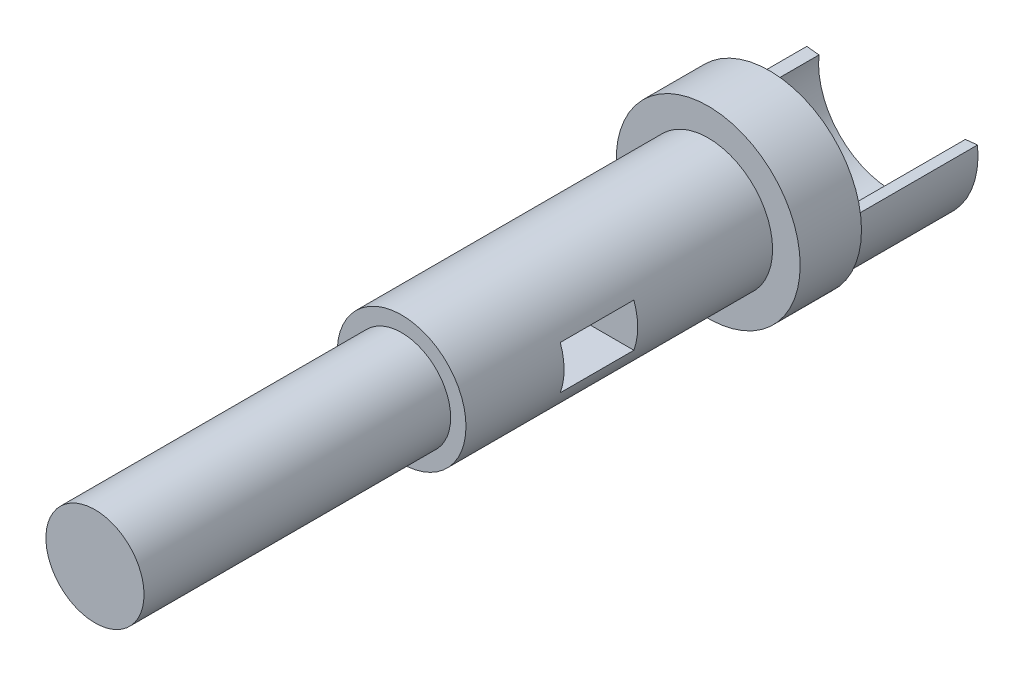
from build123d import *

# Parameters (mm, degrees)
BOSS_EXTRUDE3_DEPTH = 20
SKETCH4_W           = 12
SKETCH4_H           = 7.1
CUT_EXTRUDE1_DEPTH  = 132.719398723


with BuildPart() as part:
    # Sketch2 → Revolve4 (revolve)
    with BuildSketch(Plane(origin=(0, 0, 0), x_dir=(1, 0, 0), z_dir=(0, 1, 0))):
        Polygon((0, 0), (8, 0), (8, 50), (10.5, 50), (10.5, 100), (15, 100), (15, 110), (0, 110), align=None)
    revolve(axis=Axis((0, 0, 0), (0, 0, -1)))

    # Sketch3 → Boss-Extrude3 (add)
    with BuildSketch(Plane(origin=(0, 0, -110), x_dir=(-1, 0, 0), z_dir=(0, 0, -1))):
        with BuildLine():
            Line((-14, 0), (-12, 0))
            ThreePointArc((-12, 0), (-11.983554417, 0.628031475), (-11.934262744, 1.254341559))
            Line((-11.934262744, 1.254341559), (-13.923306535, 1.463398486))
            ThreePointArc((-13.923306535, 1.463398486), (-13.980813487, 0.732703387), (-14, 0))
        make_face()
        with BuildLine():
            Line((14, 0), (12, 0))
            ThreePointArc((12, 0), (0, -12), (-12, 0))
            Line((-12, 0), (-14, 0))
            ThreePointArc((-14, 0), (0, -14), (14, 0))
        make_face()
        with BuildLine():
            ThreePointArc((11.934262744, 1.254341559), (11.983554417, 0.628031475), (12, 0))
            Line((12, 0), (14, 0))
            ThreePointArc((14, 0), (13.980813487, 0.732703387), (13.923306535, 1.463398486))
            Line((13.923306535, 1.463398486), (11.934262744, 1.254341559))
        make_face()
    extrude(amount=BOSS_EXTRUDE3_DEPTH)

    # Sketch4 → Cut-Extrude1 (cut, through all)
    with BuildSketch(Plane(origin=(0, 0, 0), x_dir=(0, 0, -1), z_dir=(1, 0, 0))):
        with Locations((72, 0)):
            Rectangle(SKETCH4_W, SKETCH4_H)
    extrude(amount=CUT_EXTRUDE1_DEPTH, mode=Mode.SUBTRACT)


solid = part.part
